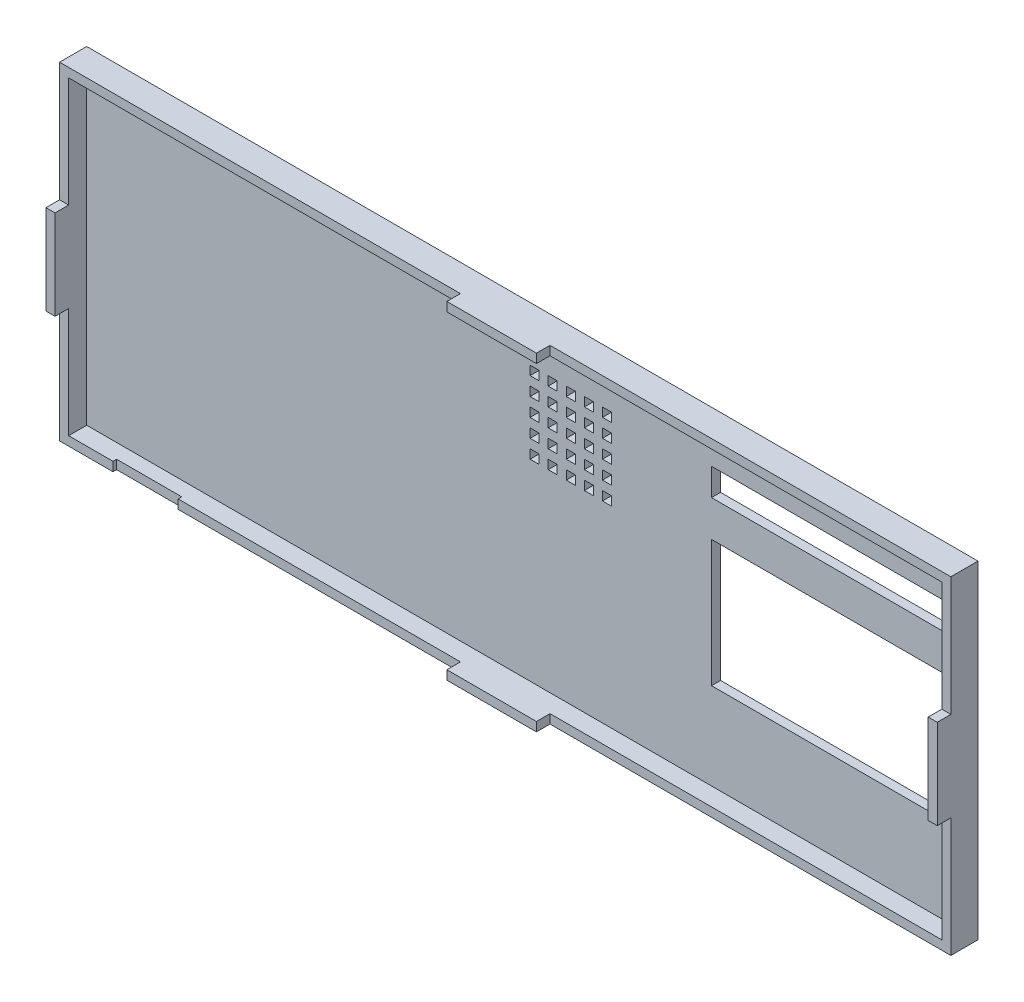
from build123d import *

# Parameters (mm, degrees)
CROQUIS1_W              = 98.5
CROQUIS1_H              = 36.25
SALIENTE_EXTRUIR1_DEPTH = 1
CROQUIS3_W              = 98.5
CROQUIS3_H              = 36.25
CROQUIS3_W_2            = 96.5
CROQUIS3_H_2            = 34.25
SALIENTE_EXTRUIR2_DEPTH = 2
CROQUIS4_W              = 1
CROQUIS4_H              = 9.9
CROQUIS4_W_2            = 9.9
CROQUIS4_H_2            = 1
SALIENTE_EXTRUIR3_DEPTH = 1.5
CROQUIS6_W              = 7.2
CROQUIS6_H              = 1
CORTAR_EXTRUIR1_DEPTH   = 0.4
CROQUIS8_W              = 26.45
CROQUIS8_H              = 14
CORTAR_EXTRUIR2_DEPTH   = 30.4
CROQUIS10_W             = 26.45
CROQUIS10_H             = 3
CORTAR_EXTRUIR3_DEPTH   = 30.4
CROQUIS11_W             = 1
CROQUIS11_H             = 1
CORTAR_EXTRUIR4_DEPTH   = 30.4
CROQUIS13_W             = 2.089529915
CROQUIS13_H             = 8.507371795
CORTAR_EXTRUIR5_DEPTH   = 0.5


with BuildPart() as part:
    # Croquis1 → Saliente-Extruir1 (new body)
    with BuildSketch(Plane.XY):
        with Locations((-8.450991985, 6.917372881)):
            Rectangle(CROQUIS1_W, CROQUIS1_H)
    extrude(amount=SALIENTE_EXTRUIR1_DEPTH)

    # Croquis3 → Saliente-Extruir2 (add)
    with BuildSketch(Plane.XY.offset(1)):
        with Locations((-8.450991985, 6.917372881)):
            Rectangle(CROQUIS3_W, CROQUIS3_H)
        with Locations((-8.450991985, 6.917372881)):
            Rectangle(CROQUIS3_W_2, CROQUIS3_H_2, mode=Mode.SUBTRACT)
    extrude(amount=SALIENTE_EXTRUIR2_DEPTH)

    # Croquis4 → Saliente-Extruir3 (add)
    with BuildSketch(Plane.XY.offset(3)):
        with Locations((-57.200991985, 6.917372881)):
            Rectangle(CROQUIS4_W, CROQUIS4_H)
        with Locations((-8.450991985, 24.542372881)):
            Rectangle(CROQUIS4_W_2, CROQUIS4_H_2)
        with Locations((-8.450991985, -10.707627119)):
            Rectangle(CROQUIS4_W_2, CROQUIS4_H_2)
        with Locations((40.299008015, 6.917372881)):
            Rectangle(CROQUIS4_W, CROQUIS4_H)
    extrude(amount=SALIENTE_EXTRUIR3_DEPTH)

    # Croquis6 → Cortar-Extruir1 (cut)
    with BuildSketch(Plane.XY.offset(3)):
        with Locations((-48.200991985, -10.707627119)):
            Rectangle(CROQUIS6_W, CROQUIS6_H)
    extrude(amount=-CORTAR_EXTRUIR1_DEPTH, mode=Mode.SUBTRACT)

    # Croquis8 → Cortar-Extruir2 (cut)
    with BuildSketch(Plane.XY.offset(1)):
        with Locations((25.574008015, 6.392372881)):
            Rectangle(CROQUIS8_W, CROQUIS8_H)
    extrude(amount=-CORTAR_EXTRUIR2_DEPTH, mode=Mode.SUBTRACT)

    # Croquis10 → Cortar-Extruir3 (cut)
    with BuildSketch(Plane(origin=(0, 0, 0), x_dir=(-1, 0, 0), z_dir=(0, 0, -1))):
        with Locations((-25.574008015, 18.892372881)):
            Rectangle(CROQUIS10_W, CROQUIS10_H)
    extrude(amount=-CORTAR_EXTRUIR3_DEPTH, mode=Mode.SUBTRACT)

    # Croquis11 → Cortar-Extruir4 (cut)
    with BuildSketch(Plane(origin=(0, 0, 0), x_dir=(-1, 0, 0), z_dir=(0, 0, -1))):
        with Locations((-0.799008015, 19.542372881)):
            Rectangle(CROQUIS11_W, CROQUIS11_H)
        with Locations((-0.799008015, 11.542372881)):
            Rectangle(CROQUIS11_W, CROQUIS11_H)
        with Locations((7.200991985, 19.542372881)):
            Rectangle(CROQUIS11_W, CROQUIS11_H)
        with Locations((5.200991985, 19.542372881)):
            Rectangle(CROQUIS11_W, CROQUIS11_H)
        with Locations((3.200991985, 19.542372881)):
            Rectangle(CROQUIS11_W, CROQUIS11_H)
        with Locations((1.200991985, 19.542372881)):
            Rectangle(CROQUIS11_W, CROQUIS11_H)
        with Locations((-0.799008015, 17.542372881)):
            Rectangle(CROQUIS11_W, CROQUIS11_H)
        with Locations((-0.799008015, 15.542372881)):
            Rectangle(CROQUIS11_W, CROQUIS11_H)
        with Locations((-0.799008015, 13.542372881)):
            Rectangle(CROQUIS11_W, CROQUIS11_H)
        with Locations((1.200991985, 17.542372881)):
            Rectangle(CROQUIS11_W, CROQUIS11_H)
        with Locations((1.200991985, 15.542372881)):
            Rectangle(CROQUIS11_W, CROQUIS11_H)
        with Locations((1.200991985, 13.542372881)):
            Rectangle(CROQUIS11_W, CROQUIS11_H)
        with Locations((1.200991985, 11.542372881)):
            Rectangle(CROQUIS11_W, CROQUIS11_H)
        with Locations((3.200991985, 11.542372881)):
            Rectangle(CROQUIS11_W, CROQUIS11_H)
        with Locations((3.200991985, 13.542372881)):
            Rectangle(CROQUIS11_W, CROQUIS11_H)
        with Locations((3.200991985, 15.542372881)):
            Rectangle(CROQUIS11_W, CROQUIS11_H)
        with Locations((3.200991985, 17.542372881)):
            Rectangle(CROQUIS11_W, CROQUIS11_H)
        with Locations((5.200991985, 17.542372881)):
            Rectangle(CROQUIS11_W, CROQUIS11_H)
        with Locations((5.200991985, 15.542372881)):
            Rectangle(CROQUIS11_W, CROQUIS11_H)
        with Locations((5.200991985, 13.542372881)):
            Rectangle(CROQUIS11_W, CROQUIS11_H)
        with Locations((5.200991985, 11.542372881)):
            Rectangle(CROQUIS11_W, CROQUIS11_H)
        with Locations((7.200991985, 11.542372881)):
            Rectangle(CROQUIS11_W, CROQUIS11_H)
        with Locations((7.200991985, 13.542372881)):
            Rectangle(CROQUIS11_W, CROQUIS11_H)
        with Locations((7.200991985, 15.542372881)):
            Rectangle(CROQUIS11_W, CROQUIS11_H)
        with Locations((7.200991985, 17.542372881)):
            Rectangle(CROQUIS11_W, CROQUIS11_H)
    extrude(amount=-CORTAR_EXTRUIR4_DEPTH, mode=Mode.SUBTRACT)

    # Croquis13 → Cortar-Extruir5 (cut)
    # profile 1 of 8: a face of its own
    with BuildSketch(Plane(origin=(0, 0, 0), x_dir=(-1, 0, 0), z_dir=(0, 0, -1))):
        Polygon((-9.257540775, 4.09189579), (-7.168010861, 4.09189579), (-7.168010861, -0.385668313), (-3.138203168, -0.385668313), (-3.138203168, 4.09189579), (-1.048673254, 4.09189579), (-1.048673254, -7.549770877), (-3.138203168, -7.549770877), (-3.138203168, -2.475198227), (-7.168010861, -2.475198227), (-7.168010861, -7.549770877), (-9.257540775, -7.549770877), align=None)
    # profile 2 of 8: a face of its own
    with BuildSketch(Plane(origin=(0, 0, 0), x_dir=(-1, 0, 0), z_dir=(0, 0, -1))):
        with BuildLine():
            Line((1.637865208, 4.09189579), (3.727395122, 4.09189579))
            Line((3.727395122, 4.09189579), (3.727395122, -3.48265015))
            add(Edge.make_bspline(
                [(3.727395122, -3.48265015), (3.727508741, -3.561179757), (3.727728193, -3.712858882), (3.738714106, -3.930468765), (3.748766975, -4.130497811), (3.766905202, -4.312727029), (3.793701581, -4.477234372), (3.81964922, -4.625076576), (3.854766783, -4.753606693), (3.907542865, -4.899907617), (3.988853484, -5.064284695), (4.121710523, -5.235602257), (4.275016181, -5.391954399), (4.458761841, -5.522095997), (4.665275714, -5.62736882), (4.893423097, -5.705364332), (5.142882383, -5.74871948), (5.315369796, -5.755338438), (5.404149596, -5.758745236)],
                knots=[0, 0, 0, 0, 1.155499968, 2.231836252, 3.205919964, 4.102923608, 4.924856345, 5.658536265, 6.31071849, 6.882491295, 7.94666036, 8.992281882, 10.060072772, 11.158554251, 12.289267114, 13.461410017, 14.693379945, 16, 16, 16, 16], degree=3))
            add(Edge.make_bspline(
                [(5.404149596, -5.758745236), (5.498467178, -5.75599298), (5.682370495, -5.750626549), (5.94688614, -5.697949211), (6.191961384, -5.614068849), (6.412407151, -5.494350195), (6.608004059, -5.350846407), (6.773572744, -5.187207119), (6.904238941, -5.003105952), (6.989402308, -4.833258606), (7.037217344, -4.676928915), (7.073057096, -4.537254268), (7.099331598, -4.372452011), (7.123168691, -4.185095885), (7.137492947, -3.973245243), (7.153025268, -3.738603814), (7.158718007, -3.47956612), (7.159688293, -3.299193312), (7.160194268, -3.205134458)],
                knots=[0, 0, 0, 0, 1.261321664, 2.459363699, 3.594844139, 4.716940403, 5.803436589, 6.833651888, 7.818396249, 8.814403945, 9.360733334, 10.004355033, 10.743453831, 11.592799886, 12.532235708, 13.585170094, 14.740740724, 16, 16, 16, 16], degree=3))
            Line((7.160194268, -3.205134458), (7.160194268, 4.09189579))
            Line((7.160194268, 4.09189579), (9.249724182, 4.09189579))
            Line((9.249724182, 4.09189579), (9.249724182, -2.852992698))
            add(Edge.make_bspline(
                [(9.249724182, -2.852992698), (9.249434013, -2.993695807), (9.248876046, -3.264254163), (9.240307354, -3.653065561), (9.222066158, -4.008182404), (9.206745657, -4.329708458), (9.177095242, -4.617210573), (9.146206465, -4.871916465), (9.106836061, -5.092923516), (9.048255268, -5.344513184), (8.947162162, -5.634209474), (8.78418682, -5.967782193), (8.577300173, -6.29437009), (8.332770495, -6.610380474), (8.056674121, -6.903943936), (7.755132698, -7.161654658), (7.43293697, -7.379650138), (7.086720223, -7.552600126), (6.716777104, -7.687488078), (6.319447303, -7.778125988), (5.895001768, -7.839362097), (5.601829214, -7.845244579), (5.450790889, -7.84827515)],
                knots=[0, 0, 0, 0, 1.170808336, 2.251350247, 3.235597562, 4.129743112, 4.929140599, 5.639994148, 6.264258765, 6.79612947, 7.788252245, 8.809469599, 9.879094798, 10.999557536, 12.129761673, 13.226370002, 14.293821979, 15.358369427, 16.438775801, 17.562147481, 18.744053101, 20, 20, 20, 20], degree=3))
            add(Edge.make_bspline(
                [(5.450790889, -7.84827515), (5.350438021, -7.846584839), (5.152443872, -7.843249889), (4.861258741, -7.813844341), (4.579771113, -7.770511622), (4.3085099, -7.707293646), (4.046533605, -7.625627829), (3.793911829, -7.525102895), (3.551583376, -7.40627956), (3.320904282, -7.270250742), (3.102158417, -7.123158992), (2.902235988, -6.960101595), (2.714257195, -6.793137262), (2.543652666, -6.615239424), (2.38914101, -6.428275706), (2.251040444, -6.231822386), (2.129556139, -6.025896914), (2.021632224, -5.806787496), (1.929259886, -5.563357591), (1.851386536, -5.286948297), (1.783354544, -4.973227174), (1.732797182, -4.621487426), (1.68696158, -4.232888347), (1.657950172, -3.806417577), (1.642772998, -3.342062881), (1.639542475, -3.020135397), (1.637865208, -2.852992698)],
                knots=[0, 0, 0, 0, 1.001158378, 1.975264943, 2.917723546, 3.841610987, 4.75185031, 5.653588123, 6.552117133, 7.442167995, 8.324307438, 9.179605724, 10.014504199, 10.831958861, 11.636465792, 12.43274043, 13.225645099, 14.020104002, 14.867201867, 15.819789774, 16.883317127, 18.068162734, 19.364263498, 20.787406516, 22.332041935, 24, 24, 24, 24], degree=3))
            Line((1.637865208, -2.852992698), (1.637865208, 4.09189579))
        make_face()
    # profile 3 of 8: a face of its own
    with BuildSketch(Plane(origin=(0, 0, 0), x_dir=(-1, 0, 0), z_dir=(0, 0, -1))):
        with BuildLine():
            Line((11.936262644, 4.09189579), (14.569163619, 4.09189579))
            add(Edge.make_bspline(
                [(14.569163619, 4.09189579), (14.774428533, 4.090460918), (15.171207934, 4.087687294), (15.74606279, 4.056435224), (16.280604654, 4.008371759), (16.775178103, 3.942251752), (17.228769181, 3.854756877), (17.640792992, 3.745011704), (18.012632386, 3.61832916), (18.348364506, 3.46926144), (18.654855639, 3.295463283), (18.945878752, 3.101866089), (19.220862427, 2.881377828), (19.483665626, 2.638252157), (19.730896817, 2.368041166), (19.966673286, 2.07522053), (20.185222154, 1.755543944), (20.393149681, 1.416676245), (20.581192462, 1.057181344), (20.745210401, 0.680119187), (20.882609224, 0.287916309), (20.994252882, -0.119845276), (21.083245763, -0.541811924), (21.145512288, -0.978835123), (21.184006074, -1.430510264), (21.187910947, -1.736632684), (21.189895122, -1.892182068)],
                knots=[0, 0, 0, 0, 1.44355588, 2.790409838, 4.047694926, 5.217575253, 6.298404546, 7.294384826, 8.214239204, 9.058592145, 9.873746385, 10.689560431, 11.514393297, 12.350027578, 13.205127629, 14.088021785, 14.991911688, 15.926770944, 16.882954281, 17.842803888, 18.816321264, 19.80318086, 20.814351908, 21.847355356, 22.906180909, 24, 24, 24, 24], degree=3))
            add(Edge.make_bspline(
                [(21.189895122, -1.892182068), (21.18469948, -2.111672373), (21.174471555, -2.543751887), (21.088317222, -3.177823596), (20.948976495, -3.78564457), (20.753050777, -4.362460198), (20.510155334, -4.903133852), (20.219989529, -5.398130979), (19.886807868, -5.844794684), (19.514491936, -6.24090095), (19.11136446, -6.581359653), (18.69243372, -6.872937618), (18.253618569, -7.102871173), (17.866961095, -7.248683432), (17.531680827, -7.339366041), (17.237308378, -7.392960337), (16.902931313, -7.442109538), (16.525431854, -7.480090984), (16.106466011, -7.513961099), (15.644363781, -7.532364802), (15.140621317, -7.547655547), (14.790724547, -7.549047291), (14.608808717, -7.549770877)],
                knots=[0, 0, 0, 0, 1.315458931, 2.589557908, 3.828601765, 5.048913369, 6.235739168, 7.376350998, 8.481830359, 9.569842114, 10.627874879, 11.640079404, 12.624025415, 13.590060155, 14.111227486, 14.704434459, 15.382649715, 16.137166398, 16.978595427, 17.902333227, 18.909396075, 20, 20, 20, 20], degree=3))
            Line((14.608808717, -7.549770877), (11.936262644, -7.549770877))
            Line((11.936262644, -7.549770877), (11.936262644, 4.09189579))
        make_face()
        with BuildLine():
            Line((14.025792558, 2.002365875), (14.025792558, -5.460240962))
            Line((14.025792558, -5.460240962), (15.117198808, -5.460240962))
            add(Edge.make_bspline(
                [(15.117198808, -5.460240962), (15.247059391, -5.460003004), (15.496824521, -5.459545331), (15.857428833, -5.437745965), (16.190896387, -5.415865413), (16.496309226, -5.374335393), (16.775890049, -5.328073874), (17.025798148, -5.263694636), (17.251185214, -5.196069699), (17.449298189, -5.109974774), (17.630753531, -5.013069205), (17.798760452, -4.899533097), (17.960934169, -4.773455531), (18.114242713, -4.631128387), (18.259266321, -4.474436342), (18.395146941, -4.302572033), (18.52369822, -4.116059823), (18.64162049, -3.913913576), (18.749378492, -3.698268001), (18.844971914, -3.471211939), (18.924232967, -3.230854504), (18.990109901, -2.97944573), (19.037186441, -2.714796819), (19.076133298, -2.438867987), (19.096211538, -2.150566028), (19.098967152, -1.95439574), (19.100365208, -1.854869034)],
                knots=[0, 0, 0, 0, 1.50275155, 2.890291501, 4.180787663, 5.369391935, 6.45668281, 7.458360028, 8.354766181, 9.177074746, 9.954075863, 10.732690366, 11.5210699, 12.329727389, 13.151100085, 13.990027547, 14.863562427, 15.770965086, 16.696477834, 17.652329173, 18.619756807, 19.62365428, 20.657822005, 21.729286259, 22.847956731, 24, 24, 24, 24], degree=3))
            add(Edge.make_bspline(
                [(19.100365208, -1.854869034), (19.097580754, -1.702353765), (19.092151286, -1.404960808), (19.039790664, -0.971801474), (18.954557561, -0.563917072), (18.832938135, -0.182821368), (18.679633078, 0.172556715), (18.487736064, 0.499206372), (18.2655056, 0.802614869), (18.089771812, 0.980604029), (18.001962764, 1.069540021)],
                knots=[0, 0, 0, 0, 1.13821349, 2.219428113, 3.251817212, 4.244760574, 5.201143372, 6.134805572, 7.068016741, 8, 8, 8, 8], degree=3))
            add(Edge.make_bspline(
                [(18.001962764, 1.069540021), (17.915374728, 1.145325509), (17.738528468, 1.300108788), (17.428044551, 1.485578739), (17.085907354, 1.64853227), (16.704289805, 1.777736247), (16.286880068, 1.87991626), (15.831192041, 1.950387317), (15.339666034, 1.995671271), (14.999148268, 2.000086532), (14.823358664, 2.002365875)],
                knots=[0, 0, 0, 0, 0.813307809, 1.661089106, 2.549956539, 3.493439533, 4.508053171, 5.589449661, 6.755572447, 8, 8, 8, 8], degree=3))
            Line((14.823358664, 2.002365875), (14.025792558, 2.002365875))
        make_face(mode=Mode.SUBTRACT)
    # profile 4 of 8: a face of its own
    with BuildSketch(Plane(origin=(0, 0, 0), x_dir=(-1, 0, 0), z_dir=(0, 0, -1))):
        with BuildLine():
            Line((22.980920763, 0.957600918), (25.070450678, 0.957600918))
            Line((25.070450678, 0.957600918), (25.070450678, -3.125844261))
            add(Edge.make_bspline(
                [(25.070450678, -3.125844261), (25.070636229, -3.22146869), (25.070992348, -3.404995323), (25.080901959, -3.668575497), (25.094807102, -3.909607496), (25.11215978, -4.128375542), (25.138059765, -4.324353425), (25.167960205, -4.497167016), (25.201857658, -4.648061459), (25.256979197, -4.816253433), (25.343217841, -5.000307201), (25.473453458, -5.19570189), (25.631206777, -5.364661163), (25.814346443, -5.508684447), (26.024742762, -5.622177957), (26.259497025, -5.699090777), (26.515655545, -5.750784189), (26.69406957, -5.756021616), (26.786850251, -5.758745236)],
                knots=[0, 0, 0, 0, 1.267339619, 2.432334223, 3.495366327, 4.467371443, 5.340232306, 6.114347373, 6.791623365, 7.387877112, 8.457231658, 9.474542289, 10.487879852, 11.508108106, 12.54995813, 13.638205937, 14.771795776, 16, 16, 16, 16], degree=3))
            add(Edge.make_bspline(
                [(26.786850251, -5.758745236), (26.879548596, -5.755636609), (27.05842403, -5.749638044), (27.316286871, -5.702859643), (27.551594072, -5.622703295), (27.766762388, -5.513980668), (27.955446493, -5.368473951), (28.119726026, -5.195092374), (28.258045539, -4.991039081), (28.324514443, -4.838821171), (28.358661816, -4.760621571)],
                knots=[0, 0, 0, 0, 1.116871431, 2.155171802, 3.144773418, 4.104381479, 5.046960687, 6.001340237, 6.973219418, 8, 8, 8, 8], degree=3))
            add(Edge.make_bspline(
                [(28.358661816, -4.760621571), (28.371192754, -4.725884608), (28.398853356, -4.649206766), (28.423471839, -4.516926939), (28.449968658, -4.3609243), (28.470928582, -4.178019647), (28.482788447, -3.969345727), (28.495495078, -3.734639538), (28.501970605, -3.474134834), (28.50281036, -3.291423336), (28.503249823, -3.1958062)],
                knots=[0, 0, 0, 0, 0.56094539, 1.238222264, 2.041156151, 2.969685991, 4.036367568, 5.220421584, 6.545382566, 8, 8, 8, 8], degree=3))
            Line((28.503249823, -3.1958062), (28.503249823, 0.957600918))
            Line((28.503249823, 0.957600918), (30.592779738, 0.957600918))
            Line((30.592779738, 0.957600918), (30.592779738, -2.61745417))
            add(Edge.make_bspline(
                [(30.592779738, -2.61745417), (30.592417938, -2.794712983), (30.591724257, -3.134571777), (30.571843808, -3.622088174), (30.544406534, -4.065337883), (30.509072605, -4.465541312), (30.458160778, -4.822864548), (30.395663797, -5.136469657), (30.326522184, -5.408428985), (30.263116747, -5.569566766), (30.233641784, -5.644474068)],
                knots=[0, 0, 0, 0, 1.388070971, 2.661352173, 3.82033814, 4.865898334, 5.806910977, 6.645039373, 7.370126333, 8, 8, 8, 8], degree=3))
            add(Edge.make_bspline(
                [(30.233641784, -5.644474068), (30.195862472, -5.725097469), (30.121289357, -5.884241135), (29.99189114, -6.110508183), (29.852392613, -6.324878286), (29.696156385, -6.522305381), (29.52637172, -6.704795997), (29.347837898, -6.876498591), (29.152514683, -7.030421172), (28.945467526, -7.170524605), (28.723807373, -7.29489324), (28.489052434, -7.405104917), (28.238665809, -7.494798323), (27.974818645, -7.570826136), (27.696294781, -7.627523987), (27.40365527, -7.670468283), (27.096579157, -7.692662058), (26.887158936, -7.696867954), (26.779854057, -7.699023013)],
                knots=[0, 0, 0, 0, 0.997311338, 1.968606903, 2.91805772, 3.860812155, 4.785445165, 5.709667791, 6.633356648, 7.568312411, 8.508286151, 9.478643871, 10.470653671, 11.485274776, 12.552984541, 13.653035246, 14.797438149, 16, 16, 16, 16], degree=3))
            add(Edge.make_bspline(
                [(26.779854057, -7.699023013), (26.663934634, -7.69764156), (26.437119633, -7.694938524), (26.105746084, -7.661836921), (25.789942638, -7.619007752), (25.493235218, -7.546190313), (25.21148017, -7.461827668), (24.947912199, -7.354158493), (24.701454301, -7.22757005), (24.471621536, -7.082812825), (24.260196404, -6.918560273), (24.062477631, -6.741912371), (23.884848428, -6.54584086), (23.721509925, -6.336400504), (23.574285072, -6.111663722), (23.443100794, -5.87242961), (23.327845972, -5.61761001), (23.266351808, -5.439017856), (23.235115809, -5.34830186)],
                knots=[0, 0, 0, 0, 1.211240017, 2.369985978, 3.478996442, 4.539426614, 5.559871561, 6.551301256, 7.510778031, 8.453136967, 9.386094087, 10.30661716, 11.221130616, 12.147659962, 13.080758632, 14.026335491, 14.997475882, 16, 16, 16, 16], degree=3))
            add(Edge.make_bspline(
                [(23.235115809, -5.34830186), (23.213805592, -5.277848344), (23.167898416, -5.126075049), (23.118332732, -4.873845546), (23.078688295, -4.583136922), (23.040123441, -4.253663223), (23.013219894, -3.884872086), (22.995635416, -3.477349201), (22.983754127, -3.030297657), (22.981893042, -2.719295888), (22.980920763, -2.556820489)],
                knots=[0, 0, 0, 0, 0.627914866, 1.352675004, 2.190563461, 3.132055958, 4.183353232, 5.345633452, 6.613289997, 8, 8, 8, 8], degree=3))
            Line((22.980920763, -2.556820489), (22.980920763, 0.957600918))
        make_face()
    # profile 5 of 8: a face of its own
    with BuildSketch(Plane(origin=(0, 0, 0), x_dir=(-1, 0, 0), z_dir=(0, 0, -1))):
        with BuildLine():
            add(Edge.make_bspline(
                [(33.573158343, 4.5396522), (33.663217068, 4.535233578), (33.840056051, 4.526557189), (34.093401957, 4.441981689), (34.325922156, 4.309242969), (34.531476459, 4.127122282), (34.702437307, 3.90963687), (34.833057745, 3.666147492), (34.905820949, 3.396369104), (34.915926682, 3.210009015), (34.921091704, 3.114760707)],
                knots=[0, 0, 0, 0, 0.989868614, 1.943702388, 2.910836514, 3.924849579, 4.949916355, 5.946401046, 6.950409252, 8, 8, 8, 8], degree=3))
            add(Edge.make_bspline(
                [(34.921091704, 3.114760707), (34.916111477, 3.020214327), (34.90640727, 2.835986203), (34.831383055, 2.569870181), (34.706005268, 2.326499067), (34.533659743, 2.112243718), (34.330333917, 1.933056191), (34.102894464, 1.79790768), (33.851976345, 1.718037097), (33.67788137, 1.708635409), (33.589482796, 1.703861602)],
                knots=[0, 0, 0, 0, 1.05296456, 2.051751585, 3.055639087, 4.085634717, 5.099016424, 6.062201612, 7.016062274, 8, 8, 8, 8], degree=3))
            add(Edge.make_bspline(
                [(33.589482796, 1.703861602), (33.498637933, 1.708264428), (33.320260459, 1.716909551), (33.064836594, 1.801682938), (32.829215171, 1.933376254), (32.624552561, 2.11921795), (32.451633829, 2.33824876), (32.326718944, 2.587406781), (32.248581593, 2.859029908), (32.239306758, 3.048150116), (32.234553242, 3.145077548)],
                knots=[0, 0, 0, 0, 0.989065327, 1.942068821, 2.907541208, 3.917690034, 4.939857478, 5.938239964, 6.943311734, 8, 8, 8, 8], degree=3))
            add(Edge.make_bspline(
                [(32.234553242, 3.145077548), (32.239726367, 3.238018474), (32.249888224, 3.420587506), (32.323087288, 3.684367931), (32.450712603, 3.923763871), (32.620442004, 4.137268008), (32.824190848, 4.31599146), (33.056571461, 4.444698818), (33.308212341, 4.525781109), (33.483931112, 4.534980761), (33.573158343, 4.5396522)],
                knots=[0, 0, 0, 0, 1.038616768, 2.040212704, 3.031499824, 4.052181184, 5.074969369, 6.039807101, 7.004644834, 8, 8, 8, 8], degree=3))
        make_face()
    # profile 6 of 8: a face of its own
    with BuildSketch(Plane(origin=(0, 0, 0), x_dir=(-1, 0, 0), z_dir=(0, 0, -1))):
        with Locations((33.577822473, -3.29608498)):
            Rectangle(CROQUIS13_W, CROQUIS13_H)
    # profile 7 of 8: a face of its own
    with BuildSketch(Plane(origin=(0, 0, 0), x_dir=(-1, 0, 0), z_dir=(0, 0, -1))):
        with BuildLine():
            Line((36.562865208, 0.957600918), (38.652395122, 0.957600918))
            Line((38.652395122, 0.957600918), (38.652395122, 0.057423968))
            add(Edge.make_bspline(
                [(38.652395122, 0.057423968), (38.771601768, 0.150145353), (38.999428842, 0.327353943), (39.345765329, 0.553295798), (39.672664093, 0.738220134), (39.987412058, 0.878883046), (40.295931214, 0.980083964), (40.603218252, 1.052790786), (40.913849296, 1.099346962), (41.12266876, 1.104352367), (41.226994481, 1.106853055)],
                knots=[0, 0, 0, 0, 1.276643801, 2.439914479, 3.493451431, 4.44993799, 5.350072675, 6.235028322, 7.118224225, 8, 8, 8, 8], degree=3))
            add(Edge.make_bspline(
                [(41.226994481, 1.106853055), (41.332818887, 1.103995286), (41.540561083, 1.098385245), (41.846450018, 1.059147555), (42.13869719, 0.987683291), (42.420588676, 0.892798078), (42.689255304, 0.767555038), (42.947988404, 0.618849248), (43.191230478, 0.437715535), (43.341029717, 0.299772796), (43.416803175, 0.229996752)],
                knots=[0, 0, 0, 0, 1.048836932, 2.058954983, 3.049370783, 4.026390553, 5.001981509, 5.982488534, 6.97947532, 8, 8, 8, 8], degree=3))
            add(Edge.make_bspline(
                [(43.416803175, 0.229996752), (43.477576278, 0.165334762), (43.599567269, 0.035537535), (43.753077605, -0.186578765), (43.884806741, -0.428726188), (43.992740463, -0.693697982), (44.072499135, -0.982949996), (44.133858571, -1.292988479), (44.16828842, -1.625549418), (44.172538947, -1.854015644), (44.174724182, -1.971472266)],
                knots=[0, 0, 0, 0, 0.889584746, 1.785680191, 2.700364693, 3.65222533, 4.649950538, 5.707241244, 6.821271309, 8, 8, 8, 8], degree=3))
            Line((44.174724182, -1.971472266), (44.174724182, -7.549770877))
            Line((44.174724182, -7.549770877), (42.085194268, -7.549770877))
            Line((42.085194268, -7.549770877), (42.085194268, -3.855780492))
            add(Edge.make_bspline(
                [(42.085194268, -3.855780492), (42.084752378, -3.735288961), (42.083905579, -3.504389306), (42.077404035, -3.173937198), (42.064709236, -2.875496032), (42.053138256, -2.608522431), (42.030419824, -2.373964332), (42.009931974, -2.170336801), (41.978495355, -1.999487165), (41.937591214, -1.815712747), (41.866162509, -1.618948625), (41.755272926, -1.411625116), (41.614593941, -1.235499174), (41.449871446, -1.089336066), (41.26128736, -0.973707642), (41.051120451, -0.892355844), (40.820497462, -0.841655405), (40.659802074, -0.836238088), (40.576348448, -0.833424723)],
                knots=[0, 0, 0, 0, 1.49886392, 2.872294502, 4.110984203, 5.214877267, 6.195405875, 7.042225351, 7.75923308, 8.355011229, 9.382752534, 10.352059385, 11.267231453, 12.171456522, 13.078624015, 14.003401117, 14.963110155, 16, 16, 16, 16], degree=3))
            add(Edge.make_bspline(
                [(40.576348448, -0.833424723), (40.467813497, -0.838928559), (40.255498034, -0.849695133), (39.948426191, -0.930884923), (39.66638582, -1.068964857), (39.411681421, -1.26003972), (39.186738843, -1.495945316), (39.001470167, -1.777289799), (38.849511794, -2.09728294), (38.784167434, -2.330929909), (38.750341837, -2.451877581)],
                knots=[0, 0, 0, 0, 0.984188326, 1.925263693, 2.85911992, 3.81709677, 4.80007086, 5.801799564, 6.862098548, 8, 8, 8, 8], degree=3))
            add(Edge.make_bspline(
                [(38.750341837, -2.451877581), (38.741934832, -2.489862008), (38.723185522, -2.574574916), (38.707766586, -2.717688116), (38.686317726, -2.887478071), (38.678281366, -3.087017503), (38.664307019, -3.315362073), (38.659138639, -3.572813875), (38.65396101, -3.858868092), (38.652934377, -4.058666094), (38.652395122, -4.163613024)],
                knots=[0, 0, 0, 0, 0.543362196, 1.211806945, 2.009705693, 2.934833164, 4.000995085, 5.207458376, 6.533175157, 8, 8, 8, 8], degree=3))
            Line((38.652395122, -4.163613024), (38.652395122, -7.549770877))
            Line((38.652395122, -7.549770877), (36.562865208, -7.549770877))
            Line((36.562865208, -7.549770877), (36.562865208, 0.957600918))
        make_face()
    # profile 8 of 8: a face of its own
    with BuildSketch(Plane(origin=(0, 0, 0), x_dir=(-1, 0, 0), z_dir=(0, 0, -1))):
        with BuildLine():
            add(Edge.make_bspline(
                [(50.317382435, 1.106853055), (50.416171376, 1.105095038), (50.611818241, 1.101613368), (50.903209807, 1.072631646), (51.189507176, 1.025346772), (51.472355947, 0.964121113), (51.749129606, 0.878334808), (52.021279797, 0.7754474), (52.291239888, 0.657320623), (52.552309524, 0.51670844), (52.806374737, 0.364201704), (53.04724368, 0.195974262), (53.272916102, 0.013347481), (53.487581251, -0.179444291), (53.681235384, -0.39079458), (53.86625404, -0.610519643), (54.032641112, -0.846491461), (54.186691573, -1.092959948), (54.323841589, -1.348499824), (54.442931156, -1.611333462), (54.546289703, -1.877827003), (54.627217374, -2.151226518), (54.694218026, -2.427926874), (54.7365002, -2.711318825), (54.766559894, -2.998491225), (54.769930538, -3.191839316), (54.771625892, -3.289088785)],
                knots=[0, 0, 0, 0, 1.022364134, 2.024744242, 3.027414945, 4.024939316, 5.017584196, 6.023349371, 7.035562955, 8.064994934, 9.090267829, 10.101425541, 11.102933353, 12.093946398, 13.084502048, 14.067315274, 15.065326281, 16.070028806, 17.074376865, 18.064572984, 19.055292013, 20.030201733, 21.013838017, 21.999348303, 22.993720005, 24, 24, 24, 24], degree=3))
            add(Edge.make_bspline(
                [(54.771625892, -3.289088785), (54.769836727, -3.387098016), (54.766279461, -3.581962585), (54.737587722, -3.871836197), (54.690121857, -4.156560808), (54.628661211, -4.437813781), (54.543195943, -4.711996216), (54.443338899, -4.983149669), (54.320760449, -5.247578217), (54.185240941, -5.508166527), (54.0302, -5.75724628), (53.863956956, -5.995581967), (53.679713249, -6.216920922), (53.48760937, -6.428127482), (53.278533399, -6.622059587), (53.055822578, -6.801866178), (52.821404964, -6.969745469), (52.573594847, -7.121758697), (52.315566261, -7.2553273), (52.05167081, -7.375750295), (51.780365381, -7.476011037), (51.502211453, -7.557770911), (51.217040336, -7.621075535), (50.925481615, -7.66407912), (50.628163199, -7.693987617), (50.427841757, -7.697333742), (50.326710694, -7.699023013)],
                knots=[0, 0, 0, 0, 1.012026251, 2.012137606, 3.004615893, 3.992048833, 4.982446996, 5.968083444, 6.973977695, 7.990229942, 8.999482246, 10.001782172, 10.988562221, 11.971415814, 12.948383116, 13.930088534, 14.925840678, 15.924049238, 16.929462851, 17.924729459, 18.917889337, 19.913673841, 20.916777188, 21.931792057, 22.95587778, 24, 24, 24, 24], degree=3))
            add(Edge.make_bspline(
                [(50.326710694, -7.699023013), (50.178836457, -7.694682613), (49.887374086, -7.686127618), (49.458118922, -7.627528138), (49.045746408, -7.526663069), (48.64958459, -7.386059388), (48.269118843, -7.205881009), (47.907669567, -6.982882904), (47.561641328, -6.721455267), (47.237027596, -6.423807707), (46.939637442, -6.09726138), (46.679831362, -5.748675166), (46.459234976, -5.383273786), (46.278046753, -5.000640559), (46.138206392, -4.600250793), (46.037217792, -4.183301511), (45.978546668, -3.748620731), (45.970064028, -3.45328607), (45.965749823, -3.303081173)],
                knots=[0, 0, 0, 0, 1.029999031, 2.030143771, 3.011211297, 3.982305373, 4.953580601, 5.938004764, 6.935448627, 7.970290061, 9.001484052, 10.007591832, 10.993831261, 11.969999897, 12.951306496, 13.942897864, 14.953773953, 16, 16, 16, 16], degree=3))
            add(Edge.make_bspline(
                [(45.965749823, -3.303081173), (45.970214477, -3.14269527), (45.978989664, -2.827459988), (46.048668515, -2.365633116), (46.159938122, -1.923455773), (46.319658635, -1.502164869), (46.523687542, -1.10098339), (46.772760599, -0.720757472), (47.068108739, -0.36140099), (47.294286273, -0.14404987), (47.409297833, -0.033526552)],
                knots=[0, 0, 0, 0, 1.043912699, 2.05178951, 3.033892, 4.007821512, 4.978932272, 5.95884105, 6.962068106, 8, 8, 8, 8], degree=3))
            add(Edge.make_bspline(
                [(47.409297833, -0.033526552), (47.514832437, 0.058084846), (47.723030362, 0.238815171), (48.061283467, 0.468041959), (48.407616478, 0.666023971), (48.766180345, 0.828802007), (49.137974651, 0.95153402), (49.521094162, 1.040871944), (49.915459213, 1.095745916), (50.182727186, 1.10313186), (50.317382435, 1.106853055)],
                knots=[0, 0, 0, 0, 1.048115528, 2.067714963, 3.060638214, 4.039924844, 5.017819947, 5.994373833, 6.98952318, 8, 8, 8, 8], degree=3))
        make_face()
        with BuildLine():
            add(Edge.make_bspline(
                [(50.364023728, -0.833424723), (50.283122864, -0.8361136), (50.123868642, -0.841406682), (49.889442243, -0.869813245), (49.667719286, -0.928034933), (49.45429594, -1.002076986), (49.252947685, -1.1010978), (49.05816031, -1.216974972), (48.880062329, -1.361980993), (48.710035011, -1.52104199), (48.555688105, -1.697674958), (48.424169885, -1.890116445), (48.306655443, -2.091004043), (48.2175502, -2.307692496), (48.143807093, -2.53425908), (48.093898643, -2.774364424), (48.059165846, -3.025326417), (48.056587428, -3.197237104), (48.055279738, -3.284424656)],
                knots=[0, 0, 0, 0, 1.030650113, 2.02884584, 2.99876339, 3.944280128, 4.900564847, 5.851248946, 6.823638398, 7.81794922, 8.81432732, 9.802856497, 10.78262424, 11.771747962, 12.779760563, 13.812642396, 14.89064281, 16, 16, 16, 16], degree=3))
            add(Edge.make_bspline(
                [(48.055279738, -3.284424656), (48.056809913, -3.37468688), (48.059800348, -3.551087064), (48.090766922, -3.808655053), (48.141831823, -4.053085368), (48.214379044, -4.284000416), (48.305619424, -4.503057677), (48.417560789, -4.709028091), (48.551384556, -4.900673239), (48.703108227, -5.077757124), (48.869239167, -5.238498125), (49.051272463, -5.376440038), (49.241585246, -5.496293252), (49.444563355, -5.592553882), (49.65732392, -5.666874898), (49.880498539, -5.721594963), (50.115259995, -5.751075481), (50.275330207, -5.756153496), (50.357027534, -5.758745236)],
                knots=[0, 0, 0, 0, 1.141730614, 2.231293227, 3.276944405, 4.297399982, 5.28939179, 6.275415646, 7.257752684, 8.24146775, 9.222424823, 10.176631434, 11.126518621, 12.063689483, 13.012557477, 13.974037417, 14.965980454, 16, 16, 16, 16], degree=3))
            add(Edge.make_bspline(
                [(50.357027534, -5.758745236), (50.438765722, -5.75644648), (50.599020021, -5.751939584), (50.83405716, -5.71819005), (51.058371473, -5.665074936), (51.27294918, -5.590114265), (51.4760554, -5.491793228), (51.668467642, -5.37136662), (51.851878581, -5.231506059), (52.020239014, -5.06773218), (52.176087047, -4.890096035), (52.312756451, -4.697439205), (52.426962558, -4.491468738), (52.520632017, -4.273480601), (52.593321455, -4.043774416), (52.643540966, -3.801496396), (52.678292333, -3.547397377), (52.680812437, -3.373164803), (52.682095977, -3.284424656)],
                knots=[0, 0, 0, 0, 1.031504075, 2.022346795, 2.991027682, 3.937587355, 4.885570121, 5.833146507, 6.798790848, 7.791235734, 8.792807298, 9.778388351, 10.766749885, 11.760164525, 12.768777521, 13.802286646, 14.880660483, 16, 16, 16, 16], degree=3))
            add(Edge.make_bspline(
                [(52.682095977, -3.284424656), (52.680546336, -3.195715524), (52.677505437, -3.021639431), (52.646536656, -2.767196747), (52.595972892, -2.525701837), (52.522489971, -2.298185864), (52.431791911, -2.082053232), (52.319773173, -1.878410242), (52.185289429, -1.688259889), (52.032828187, -1.512545043), (51.864206841, -1.354059603), (51.685334082, -1.212729064), (51.49211964, -1.095837851), (51.288188335, -0.999477763), (51.072997603, -0.925342432), (50.84678903, -0.870312254), (50.608869357, -0.841251231), (50.446491915, -0.836060824), (50.364023728, -0.833424723)],
                knots=[0, 0, 0, 0, 1.123894411, 2.205445421, 3.243160173, 4.246488011, 5.231014757, 6.210004299, 7.185865357, 8.177612767, 9.153374344, 10.115157457, 11.061423229, 12.009021698, 12.96873347, 13.94135618, 14.954456845, 16, 16, 16, 16], degree=3))
        make_face(mode=Mode.SUBTRACT)
    extrude(amount=-CORTAR_EXTRUIR5_DEPTH, mode=Mode.SUBTRACT)


solid = part.part
